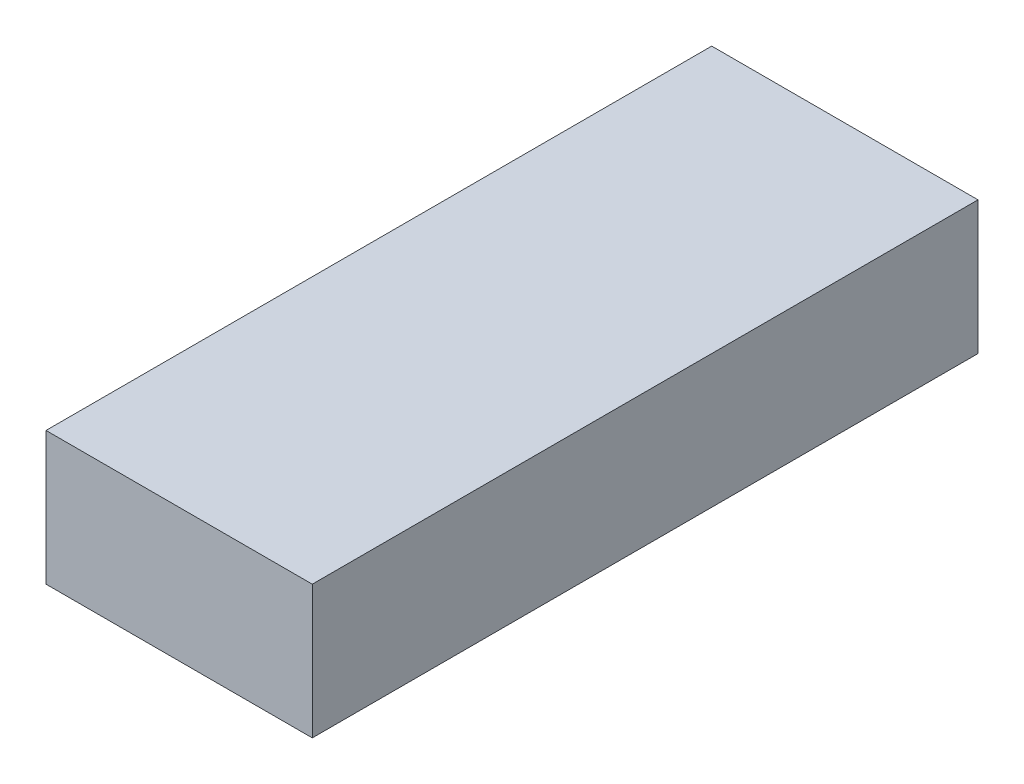
from build123d import *

# Parameters (mm, degrees)
SKETCH1_W           = 6
SKETCH1_H           = 3
BOSS_EXTRUDE1_DEPTH = 7.5


with BuildPart() as part:
    # Sketch1 → Boss-Extrude1 (new, symmetric)
    with BuildSketch(Plane.XY):
        Rectangle(SKETCH1_W, SKETCH1_H)
    extrude(amount=BOSS_EXTRUDE1_DEPTH, both=True)


solid = part.part
